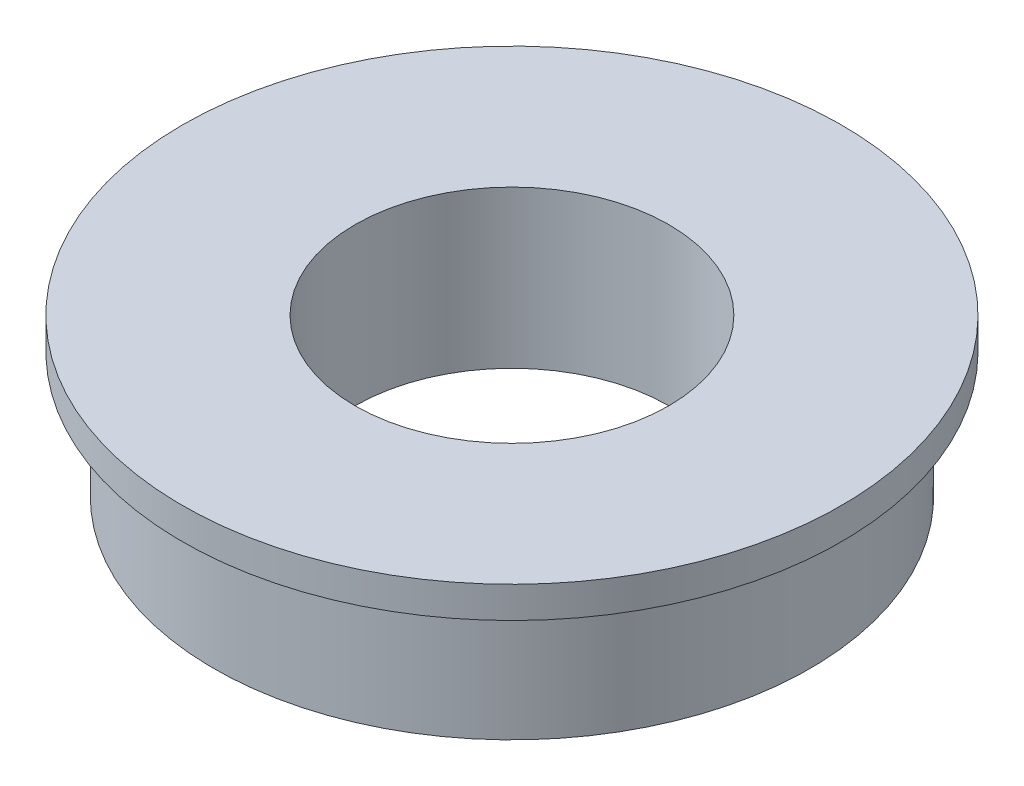
from build123d import *


with BuildPart() as part:
    # 草图1 → 旋转1 (revolve)
    with BuildSketch(Plane.XY, mode=Mode.PRIVATE) as revolve_1_sk:
        Polygon((5, 2.467105263), (10.5, 2.467105263), (10.5, 1.467105263), (9.5, 1.467105263), (9.5, -2.532894737), (5, -2.532894737), align=None)
    revolve(revolve_1_sk.sketch.rotate(Axis((0, 8.453947368, 0), (0, -1, 0)), 180), axis=Axis((0, 8.453947368, 0), (0, -1, 0)))


solid = part.part
